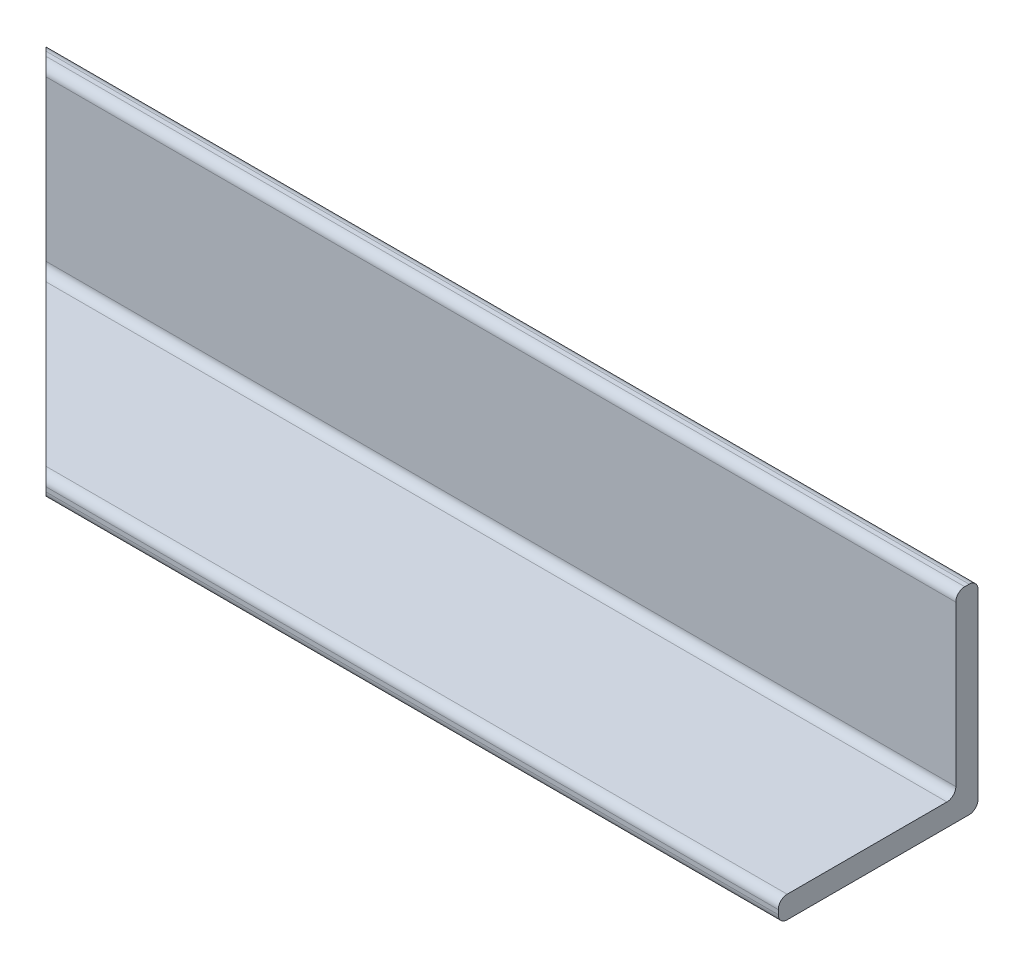
from build123d import *

# Parameters (mm, degrees)
SKETCH1_W           = 105
SKETCH1_H           = 22.5
BOSS_EXTRUDE1_DEPTH = 2.5
SKETCH2_W           = 105
SKETCH2_H           = 2.5
BOSS_EXTRUDE2_DEPTH = 20
CUT_EXTRUDE1_DEPTH  = 59.215655111
FILLET1_R           = 1


with BuildPart() as part:
    # Sketch1 → Boss-Extrude1 (new body)
    with BuildSketch(Plane(origin=(0, 0, 0), x_dir=(1, 0, 0), z_dir=(0, 1, 0))):
        Rectangle(SKETCH1_W, SKETCH1_H)
    extrude(amount=BOSS_EXTRUDE1_DEPTH)

    # Sketch2 → Boss-Extrude2 (add)
    with BuildSketch(Plane(origin=(0, 2.5, 0), x_dir=(1, 0, 0), z_dir=(0, 1, 0))):
        with Locations((0, 10)):
            Rectangle(SKETCH2_W, SKETCH2_H)
    extrude(amount=BOSS_EXTRUDE2_DEPTH)

    # Sketch3 → Cut-Extrude1 (cut, through all)
    with BuildSketch(Plane(origin=(0, 0, 0), x_dir=(-1, 0, 0), z_dir=(0, -1, 0))):
        Polygon((52.5, -11.25), (52.5, 11.25), (30, -11.25), align=None)
    extrude(amount=-CUT_EXTRUDE1_DEPTH, mode=Mode.SUBTRACT)

    # Fillet1
    fillet1_edges = [part.edges().sort_by_distance(p)[0] for p in [
        (0, 22.5, -11.25),
        (1.25, 22.5, -8.75),
        (1.25, 2.5, -8.75),
        (11.25, 0, 11.25),
        (11.25, 2.5, 11.25),
        (0, 0, -11.25),
    ]]
    fillet(fillet1_edges, radius=FILLET1_R)


solid = part.part
